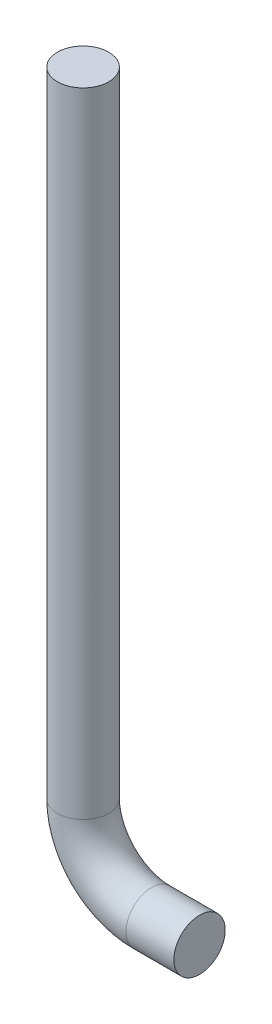
from build123d import *

# Parameters (mm, degrees)
SKETCH_2_R = 7.5


with BuildPart() as part:
    # 扫描1: sweep along a path in 草图1
    with BuildLine(Plane.XY) as sweep_1_path:
        Line((0, 0), (0, -185))
        ThreePointArc((0, -185), (5.857864376, -199.142135624), (20, -205))
        Line((20, -205), (34, -205))
    # 草图2 → 扫描1 (sweep)
    with BuildSketch(Plane(origin=(0, 0, 0), x_dir=(1, 0, 0), z_dir=(0, 1, 0))):
        Circle(SKETCH_2_R)
    sweep(path=sweep_1_path.line)


solid = part.part
